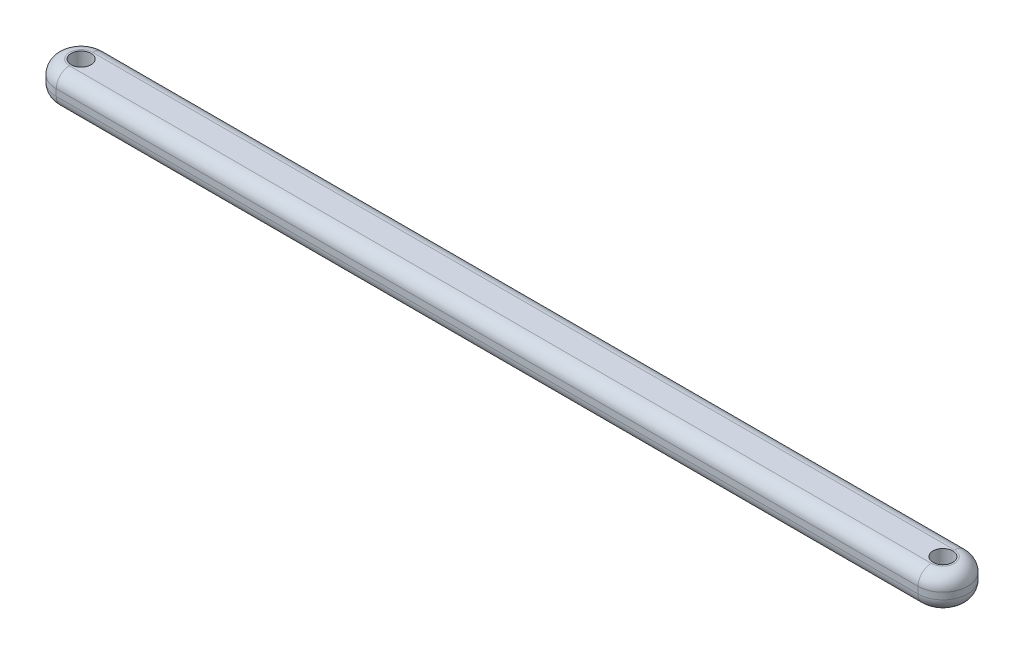
from build123d import *

# Parameters (mm, degrees)
CROQUIS1_R              = 3
SALIENTE_EXTRUIR1_DEPTH = 5
REDONDEO3_R             = 4


with BuildPart() as part:
    # Croquis1 → Saliente-Extruir1 (new, symmetric)
    with BuildSketch(Plane(origin=(0, 0, 0), x_dir=(-1, 0, 0), z_dir=(0, 1, 0))):
        with BuildLine():
            Line((0, -7.5), (260, -7.5))
            ThreePointArc((260, -7.5), (267.5, 0), (260, 7.5))
            Line((260, 7.5), (0, 7.5))
            ThreePointArc((0, 7.5), (-7.5, 0), (0, -7.5))
        make_face()
        with Locations(Location((0, 0, 0), (0, 0, 90))):
            Circle(CROQUIS1_R, mode=Mode.SUBTRACT)
        with Locations(Location((260, 0, 0), (0, 0, 90))):
            Circle(CROQUIS1_R, mode=Mode.SUBTRACT)
    extrude(amount=SALIENTE_EXTRUIR1_DEPTH, both=True)

    # Redondeo3
    redondeo3_edges = [part.edges().sort_by_distance(p)[0] for p in [
        (7.5, 5, 0),
        (-130, 5, -7.5),
        (-267.5, 5, 0),
        (-130, -5, -7.5),
        (7.5, -5, 0),
        (-130, -5, 7.5),
        (-267.5, -5, 0),
        (-130, 5, 7.5),
    ]]
    fillet(redondeo3_edges, radius=REDONDEO3_R)


solid = part.part
